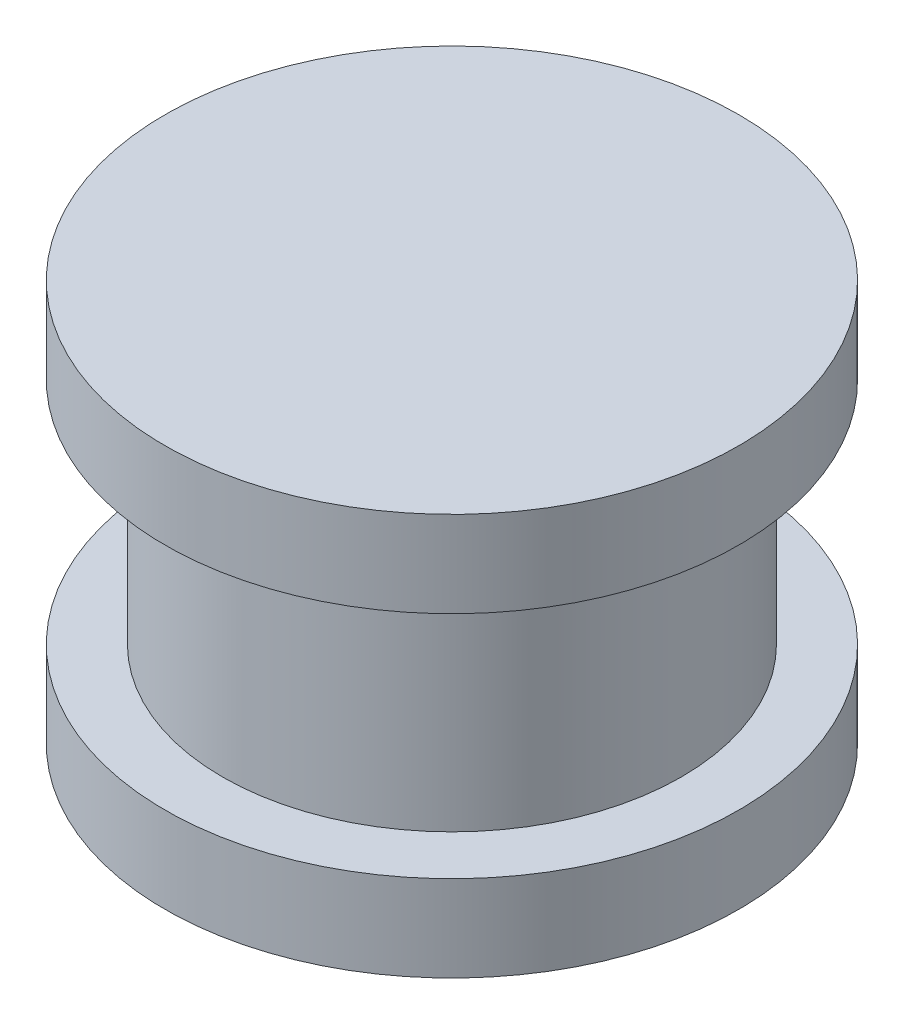
from build123d import *

# Parameters (mm, degrees)
ECHELLE1_SCALE = 0.69


with BuildPart() as part:
    # Esquisse1 → Révolution1 (revolve)
    with BuildSketch(Plane.XY, mode=Mode.PRIVATE) as r_volution1_sk:
        Polygon((0, -0.35), (0, 0.35), (0.5, 0.35), (0.5, 0.2), (0.4, 0.2), (0.4, -0.2), (0.5, -0.2), (0.5, -0.35), align=None)
    revolve(r_volution1_sk.sketch.rotate(Axis((0, -0.35, 0), (0, 1, 0)), 90), axis=Axis((0, -0.35, 0), (0, 1, 0)))


with BuildPart() as part_1:
    # Echelle1: scaled about (0, 0, 0)
    add(part.part.scale(ECHELLE1_SCALE))


solid = part_1.part
